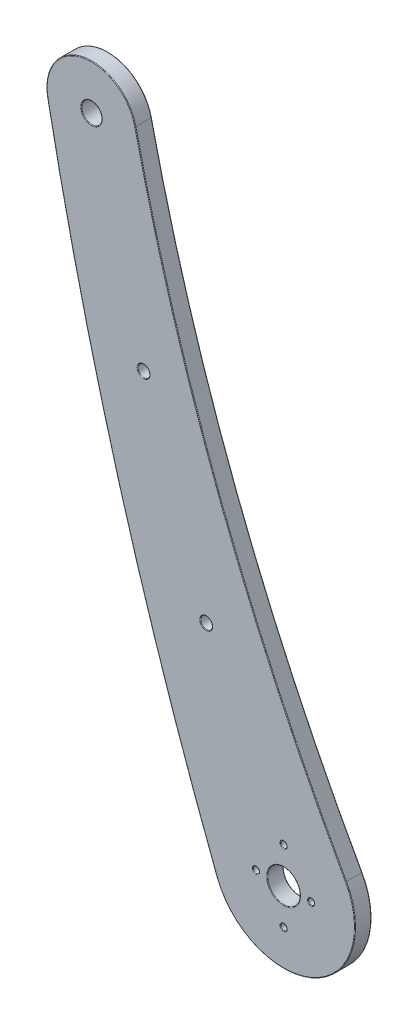
from build123d import *

# Parameters (mm, degrees)
SKETCH_1_R           = 4
SKETCH_1_R_2         = 2.5
SKETCH_1_R_3         = 0.75
EXTRUDE_1_DEPTH      = 4
HOLE_WIZARD_M3_5_1_D = 2.9
FILLET_1_R           = 0.15


with BuildPart() as part:
    # 草图1 → 凸台-拉伸1 (new body)
    with BuildSketch(Plane.XY):
        with BuildLine():
            ThreePointArc((-57.41248308, 202.31271038), (-36.490544421, 133.347556284), (-5.871308636, 68.106599848))
            ThreePointArc((-5.871308636, 68.106599848), (-13.690649344, 43.712099509), (-37.46456891, 53.253298823))
            ThreePointArc((-37.46456891, 53.253298823), (-61.406032134, 124.60733653), (-78.941773485, 197.79948183))
            ThreePointArc((-78.941773485, 197.79948183), (-70.398423924, 210.652262108), (-57.41248308, 202.31271038))
        make_face()
        with Locations((-21.136304007, 59.549151844)):
            Circle(SKETCH_1_R, mode=Mode.SUBTRACT)
        with Locations((-68.141528865, 199.886277495)):
            Circle(SKETCH_1_R_2, mode=Mode.SUBTRACT)
        with Locations((-14.386304007, 59.549151844)):
            Circle(SKETCH_1_R_3, mode=Mode.SUBTRACT)
        with Locations((-21.136304007, 50.799151844)):
            Circle(SKETCH_1_R_3, mode=Mode.SUBTRACT)
        with Locations(Location((-27.886304007, 59.549151844, 0), (0, 0, 180))):
            Circle(SKETCH_1_R_3, mode=Mode.SUBTRACT)
        with Locations(Location((-21.136304007, 68.299151844, 0), (0, 0, 180))):
            Circle(SKETCH_1_R_3, mode=Mode.SUBTRACT)
    extrude(amount=-EXTRUDE_1_DEPTH)

    # M3.5 螺纹孔的螺纹孔钻头1 (through all)
    with Locations(Plane.XY):
        with Locations((-55.398068486, 151.5375007), (-40.081827184, 105.810813755)):
            Hole(HOLE_WIZARD_M3_5_1_D / 2)

    # 圆角1
    fillet_1_edges = [part.edges().sort_by_distance(p)[0] for p in [
        (-25.136304007, 59.549151844, -4),
        (-25.136304007, 59.549151844, 0),
        (-13.690649344, 43.712099509, -4),
        (-70.641528865, 199.886277495, -4),
        (-70.641528865, 199.886277495, 0),
        (-36.490544421, 133.347556284, -4),
        (-15.136304007, 59.549151844, -4),
        (-15.136304007, 59.549151844, 0),
        (-21.886304007, 50.799151844, -4),
        (-21.886304007, 50.799151844, 0),
        (-27.136304007, 59.549151844, -4),
        (-27.136304007, 59.549151844, 0),
        (-20.386304007, 68.299151844, -4),
        (-20.386304007, 68.299151844, 0),
        (-38.631827184, 105.810813755, 0),
        (-38.631827184, 105.810813755, -4),
        (-53.948068486, 151.5375007, 0),
        (-53.948068486, 151.5375007, -4),
        (-70.398423924, 210.652262108, -4),
        (-36.490544421, 133.347556284, 0),
        (-13.690649344, 43.712099509, 0),
        (-61.406032134, 124.60733653, 0),
        (-70.398423924, 210.652262108, 0),
        (-61.406032134, 124.60733653, -4),
    ]]
    fillet(fillet_1_edges, radius=FILLET_1_R)


solid = part.part
